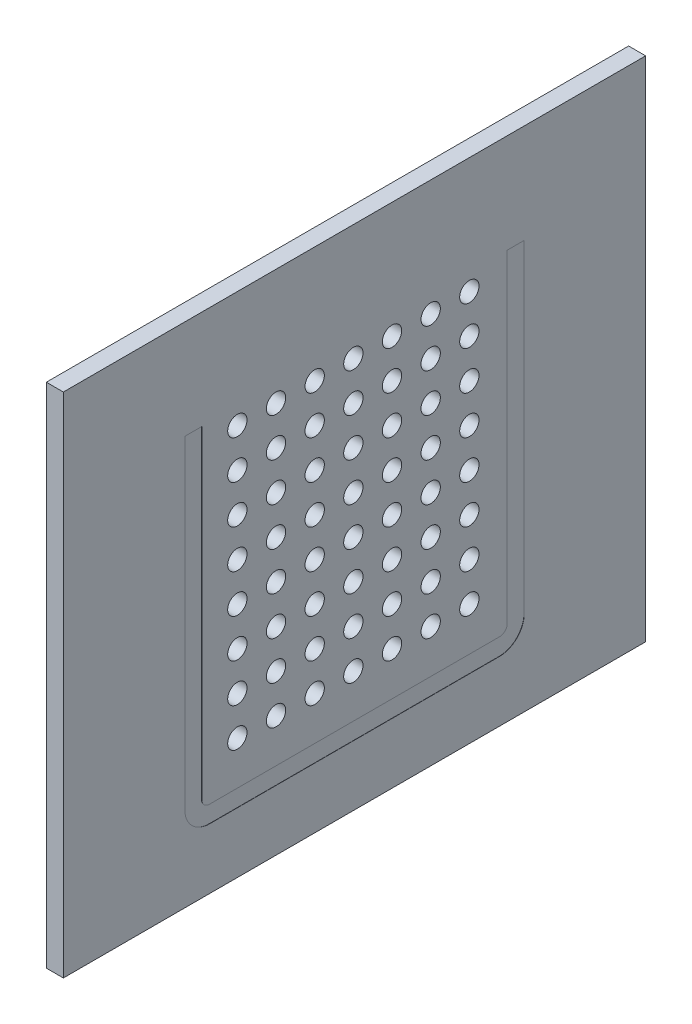
from build123d import *

# Parameters (mm, degrees)
SKETCH1_W            = 191.262
SKETCH1_H            = 166.6875
BOSS_EXTRUDE1_DEPTH  = 5.588
CUT_EXTRUDE2_REACH   = 128.975
SKETCH6_R            = 3.175
LPATTERN1_COUNT      = 7
LPATTERN1_PITCH      = 12.7
LPATTERN1_COUNT_DIR2 = 8
LPATTERN1_PITCH_DIR2 = 12.7
CUT_EXTRUDE3_DEPTH   = 0.0762


with BuildPart() as part:
    # Sketch1 → Boss-Extrude1 (new body)
    with BuildSketch(Plane(origin=(0, 0, 0), x_dir=(0, 0, -1), z_dir=(1, 0, 0))):
        Rectangle(SKETCH1_W, SKETCH1_H)
    extrude(amount=BOSS_EXTRUDE1_DEPTH)

    # Sketch6 → Cut-Extrude2 (cut, up to next)
    with BuildSketch(Plane(origin=(5.588, 0, 0), x_dir=(0, 0, -1), z_dir=(1, 0, 0)), mode=Mode.PRIVATE) as cut_extrude2_sk1:
        with Locations((-38.481, 45.24375)):
            Circle(SKETCH6_R)
    cut_extrude2_tool1 = extrude(cut_extrude2_sk1.sketch, amount=-CUT_EXTRUDE2_REACH, mode=Mode.PRIVATE) & part.part
    cut_extrude2 = cut_extrude2_tool1.solids().sort_by_distance((5.588, 45.24375, 38.481))[0]
    add(cut_extrude2, mode=Mode.SUBTRACT)

    # LPattern1: Cut-Extrude2 7 × 8
    with Locations(*[(0, -j * LPATTERN1_PITCH_DIR2, -i * LPATTERN1_PITCH) for i in range(LPATTERN1_COUNT) for j in range(LPATTERN1_COUNT_DIR2) if (i, j) != (0, 0)]):
        add(cut_extrude2, mode=Mode.SUBTRACT)

    # Sketch7 → Cut-Extrude3 (cut)
    with BuildSketch(Plane(origin=(5.588, 0, 0), x_dir=(0, 0, -1), z_dir=(1, 0, 0))):
        with BuildLine():
            Line((-55.753, -55.372), (-55.753, 50.8))
            Line((-55.753, 50.8), (-50.165, 50.8))
            Line((-50.165, 50.8), (-50.165, -55.372))
            ThreePointArc((-50.165, -55.372), (-49.421051224, -57.168051224), (-47.625, -57.912))
            Line((-47.625, -57.912), (47.625, -57.912))
            ThreePointArc((47.625, -57.912), (49.421051224, -57.168051224), (50.165, -55.372))
            Line((50.165, -55.372), (50.165, 50.8))
            Line((50.165, 50.8), (55.753, 50.8))
            Line((55.753, 50.8), (55.753, -55.372))
            ThreePointArc((55.753, -55.372), (53.372363917, -61.119363917), (47.625, -63.5))
            Line((47.625, -63.5), (-47.625, -63.5))
            ThreePointArc((-47.625, -63.5), (-53.372363917, -61.119363917), (-55.753, -55.372))
        make_face()
    extrude(amount=-CUT_EXTRUDE3_DEPTH, mode=Mode.SUBTRACT)


solid = part.part
